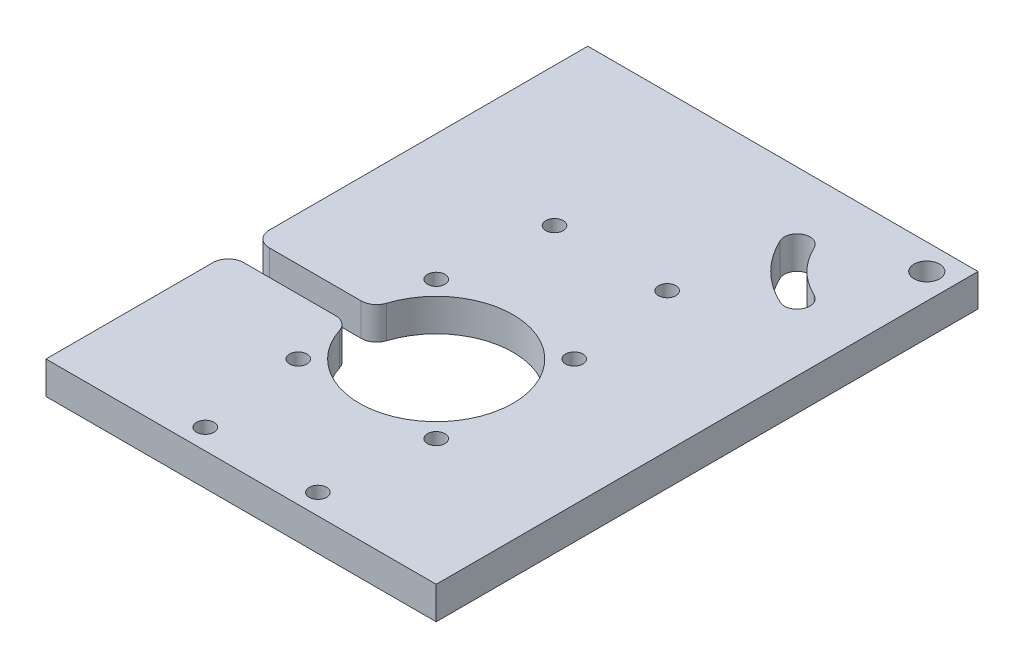
from build123d import *

# Parameters (mm, degrees)
SKETCH1_R            = 2.5
BOSS_EXTRUDE1_DEPTH  = 6.35
M3_CLEARANCE_HOLE1_D = 3.4
CIRPATTERN1_COUNT    = 4
M3_CLEARANCE_HOLE3_D = 3.4
FILLET1_R            = 3


with BuildPart() as part:
    # Sketch1 → Boss-Extrude1 (new body)
    with BuildSketch(Plane(origin=(0, 0, 0), x_dir=(1, 0, 0), z_dir=(0, 1, 0))):
        with BuildLine():
            Line((-38.1, 67.7), (38.1, 67.7))
            Line((38.1, 67.7), (38.1, -38.1))
            Line((38.1, -38.1), (-38.1, -38.1))
            Line((-38.1, -38.1), (-38.1, -2.5))
            Line((-38.1, -2.5), (-14.790199458, -2.5))
            ThreePointArc((-14.790199458, -2.5), (15, 0), (-14.790199458, 2.5))
            Line((-14.790199458, 2.5), (-38.1, 2.5))
            Line((-38.1, 2.5), (-38.1, 67.7))
        make_face()
        with Locations(Location((33.1, 62.7, 0), (0, 0, 270))):
            Circle(SKETCH1_R, mode=Mode.SUBTRACT)
        with BuildLine():
            ThreePointArc((26.105667768, 47.700606125), (21.397382771, 50.997382771), (18.100606125, 55.705667768))
            ThreePointArc((18.100606125, 55.705667768), (14.778291003, 56.914891581), (13.569067189, 53.592576459))
            ThreePointArc((13.569067189, 53.592576459), (17.861848865, 47.461848865), (23.992576459, 43.169067189))
            ThreePointArc((23.992576459, 43.169067189), (27.314891581, 44.378291003), (26.105667768, 47.700606125))
        make_face(mode=Mode.SUBTRACT)
    extrude(amount=BOSS_EXTRUDE1_DEPTH)

    # M3 Clearance Hole1 (through all)
    with Locations(Plane(origin=(0, 6.35, 0), x_dir=(1, 0, 0), z_dir=(0, 1, 0))):
        with Locations((13.470384182, 13.470384182)):
            m3_clearance_hole1 = Hole(M3_CLEARANCE_HOLE1_D / 2)

    # CirPattern1: M3 Clearance Hole1 ×4 about axis
    cirpattern1_axis = Axis((0, 0, 0), (0, 1, 0))
    for i in range(1, CIRPATTERN1_COUNT):
        add(m3_clearance_hole1.rotate(cirpattern1_axis, i * 360 / CIRPATTERN1_COUNT), mode=Mode.SUBTRACT)

    # M3 Clearance Hole3 (through all)
    with Locations(Plane(origin=(0, 6.35, 0), x_dir=(1, 0, 0), z_dir=(0, 1, 0))):
        with Locations((11, 34.1), (-11, -34.1), (11, -34.1), (-11, 34.1)):
            Hole(M3_CLEARANCE_HOLE3_D / 2)

    # Fillet1
    fillet1_edges = [part.edges().sort_by_distance(p)[0] for p in [
        (-14.790199458, 3.175, -2.5),
        (-38.1, 3.175, -2.5),
        (-38.1, 3.175, 2.5),
        (-14.790199458, 3.175, 2.5),
    ]]
    fillet(fillet1_edges, radius=FILLET1_R)


solid = part.part
